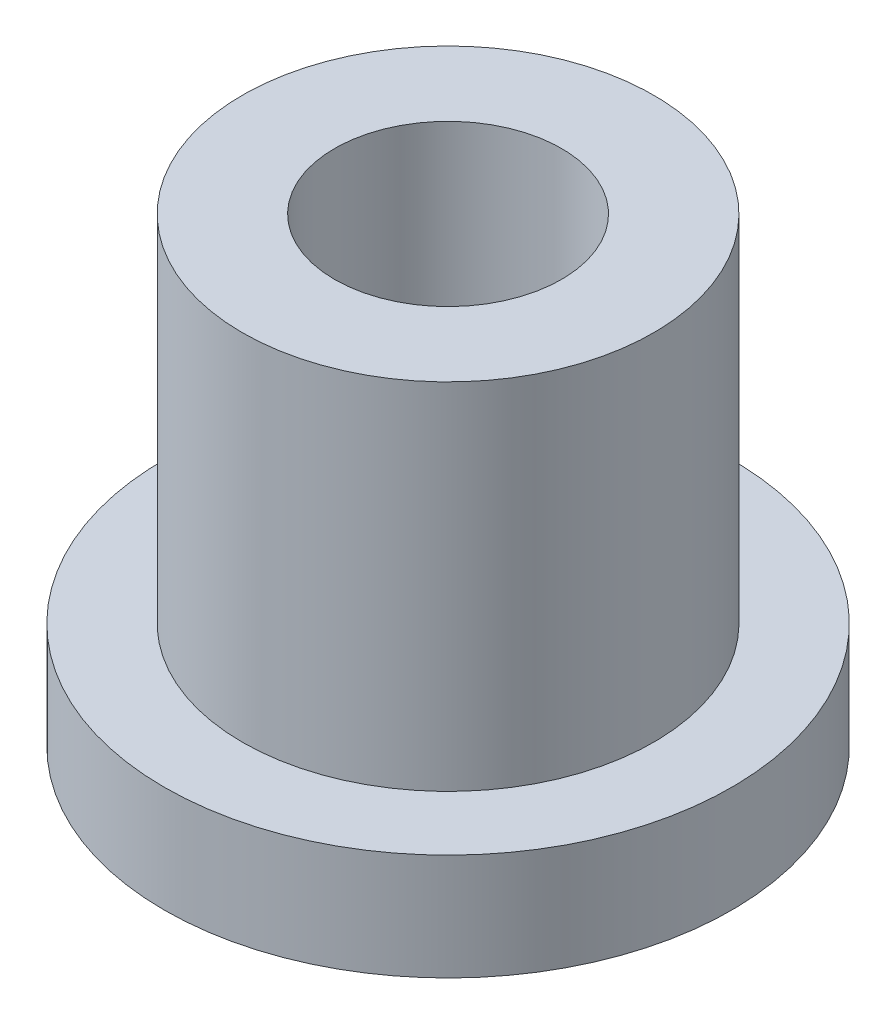
from build123d import *

# Parameters (mm, degrees)
SKETCH_1_R          = 4
EXTRUDE_1_DEPTH     = 1.5
SKETCH_2_R          = 2.9
EXTRUDE_2_DEPTH     = 5
CUT_EXTRUDE_1_REACH = 10.617
SKETCH_3_R          = 1.6


with BuildPart() as part:
    # 草图1 → 凸台-拉伸1 (new body)
    with BuildSketch(Plane(origin=(0, 0, 0), x_dir=(1, 0, 0), z_dir=(0, 1, 0))):
        with Locations(Location((0, 0, 0), (0, 0, 270))):
            Circle(SKETCH_1_R)
    extrude(amount=EXTRUDE_1_DEPTH)

    # 草图2 → 凸台-拉伸2 (add)
    with BuildSketch(Plane(origin=(0, 1.5, 0), x_dir=(1, 0, 0), z_dir=(0, 1, 0))):
        with Locations(Location((0, 0, 0), (0, 0, 270))):
            Circle(SKETCH_2_R)
    extrude(amount=EXTRUDE_2_DEPTH)

    # 草图3 → 切除-拉伸1 (cut, up to next)
    with BuildSketch(Plane(origin=(0, 6.5, 0), x_dir=(1, 0, 0), z_dir=(0, 1, 0)), mode=Mode.PRIVATE) as cut_extrude_1_sk1:
        with Locations(Location((0, 0, 0), (0, 0, 270))):
            Circle(SKETCH_3_R)
    cut_extrude_1_tool1 = extrude(cut_extrude_1_sk1.sketch, amount=-CUT_EXTRUDE_1_REACH, mode=Mode.PRIVATE) & part.part
    add(cut_extrude_1_tool1.solids().sort_by_distance((0, 6.5, 0))[0], mode=Mode.SUBTRACT)


solid = part.part
